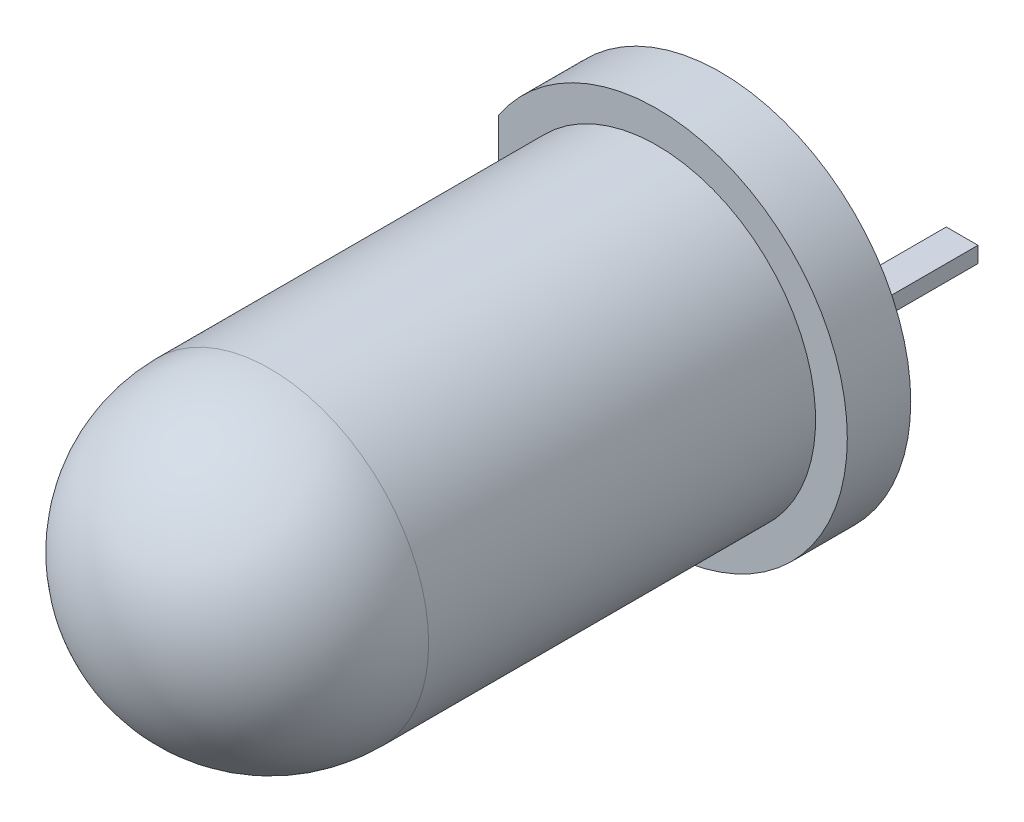
from build123d import *

# Parameters (mm, degrees)
ESBO_O1_R                = 2.5
RESSALTO_EXTRUS_O1_DEPTH = 8.6
RESSALTO_EXTRUS_O2_DEPTH = 1
FILETE1_R                = 2.5
ESBO_O3_W                = 0.5
ESBO_O3_H                = 0.25
RESSALTO_EXTRUS_O3_DEPTH = 2.54
ESBO_O4_W                = 0.935535929
ESBO_O4_H                = 0.753626165
CORTE_EXTRUS_O1_DEPTH    = 1


with BuildPart() as part:
    # Esboço1 → Ressalto-extrusão1 (new body)
    with BuildSketch(Plane.XY):
        with Locations(Location((0, 0, 0), (0, 0, 180))):
            Circle(ESBO_O1_R)
    extrude(amount=RESSALTO_EXTRUS_O1_DEPTH)

    # Esboço2 → Ressalto-extrusão2 (add)
    with BuildSketch(Plane(origin=(0, 0, 0), x_dir=(-1, 0, 0), z_dir=(0, 0, -1))):
        with BuildLine():
            Line((2.5, 0), (2.5, 1.658312395))
            ThreePointArc((2.5, 1.658312395), (-3, 0), (2.5, -1.658312395))
            Line((2.5, -1.658312395), (2.5, 0))
        make_face()
    extrude(amount=RESSALTO_EXTRUS_O2_DEPTH)

    # Filete1
    filete1_edges = [part.edges().sort_by_distance(p)[0] for p in [
        (2.5, 0, 8.6),
    ]]
    fillet(filete1_edges, radius=FILETE1_R)

    # Esboço3 → Ressalto-extrusão3 (add)
    with BuildSketch(Plane(origin=(0, 0, -1), x_dir=(-1, 0, 0), z_dir=(0, 0, -1))):
        with Locations((1.27, 0)):
            Rectangle(ESBO_O3_W, ESBO_O3_H)
        with Locations((-1.27, 0)):
            Rectangle(ESBO_O3_W, ESBO_O3_H)
    extrude(amount=RESSALTO_EXTRUS_O3_DEPTH)

    # Esboço4 → Corte-extrusão1 (cut)
    with BuildSketch(Plane(origin=(0, 0, -3.54), x_dir=(-1, 0, 0), z_dir=(0, 0, -1))):
        with Locations((1.289457258, 0.005956527)):
            Rectangle(ESBO_O4_W, ESBO_O4_H)
    extrude(amount=-CORTE_EXTRUS_O1_DEPTH, mode=Mode.SUBTRACT)


solid = part.part
